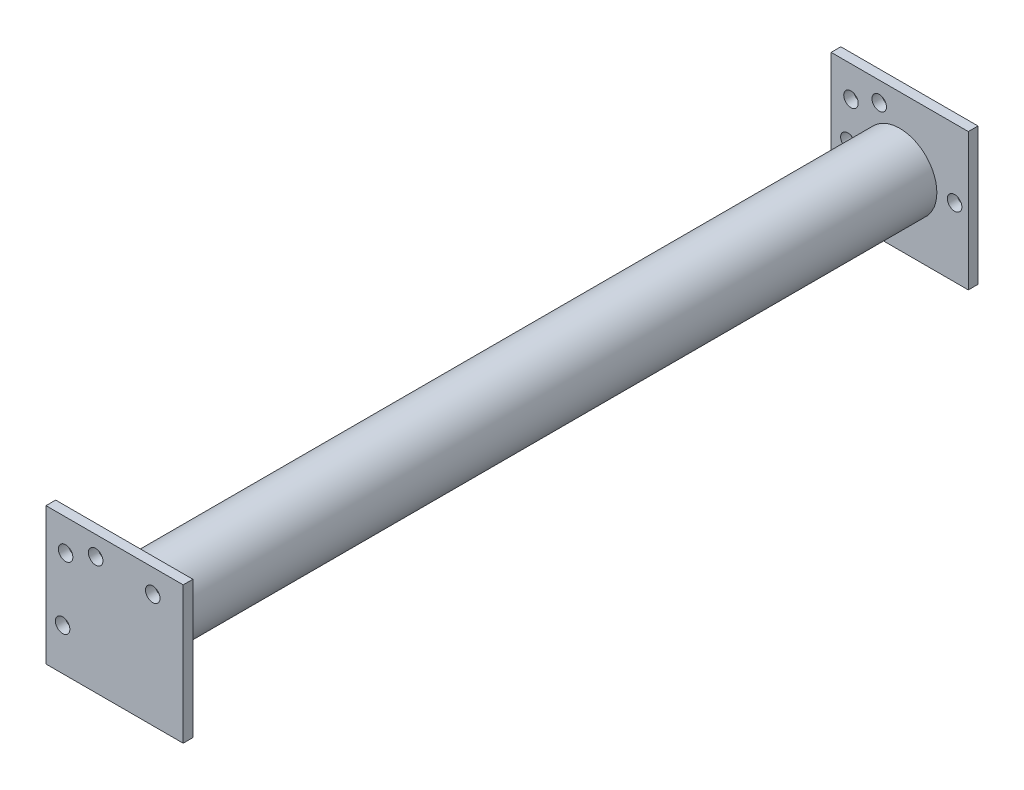
from build123d import *

# Parameters (mm, degrees)
SKETCH1_R           = 46
SKETCH1_R_2         = 40
BOSS_EXTRUDE1_DEPTH = 961
SKETCH2_W           = 170
SKETCH2_H           = 170
SKETCH2_R           = 9
BOSS_EXTRUDE2_DEPTH = 12
SKETCH3_W           = 170
SKETCH3_H           = 170
SKETCH3_R           = 9
BOSS_EXTRUDE3_DEPTH = 12


with BuildPart() as part:
    # Sketch1 → Boss-Extrude1 (new body)
    with BuildSketch(Plane.XY):
        Circle(SKETCH1_R)
        Circle(SKETCH1_R_2, mode=Mode.SUBTRACT)
    extrude(amount=BOSS_EXTRUDE1_DEPTH)

    # Sketch2 → Boss-Extrude2 (add)
    with BuildSketch(Plane(origin=(0, 0, 0), x_dir=(-1, 0, 0), z_dir=(0, 0, -1))):
        Rectangle(SKETCH2_W, SKETCH2_H)
        with Locations((64.227589169, 0)):
            Circle(SKETCH2_R, mode=Mode.SUBTRACT)
        with Locations((-68.030538528, 0)):
            Circle(SKETCH2_R, mode=Mode.SUBTRACT)
        with Locations((60.407969797, 46.896616819)):
            Circle(SKETCH2_R, mode=Mode.SUBTRACT)
        with Locations((25.416815813, 60.663628222)):
            Circle(SKETCH2_R, mode=Mode.SUBTRACT)
    extrude(amount=BOSS_EXTRUDE2_DEPTH)

    # Sketch3 → Boss-Extrude3 (add)
    with BuildSketch(Plane.XY.offset(961)):
        Rectangle(SKETCH3_W, SKETCH3_H)
        with Locations((47.306709653, 56.060313407)):
            Circle(SKETCH3_R, mode=Mode.SUBTRACT)
        with Locations((-23.467107938, 60.902732505)):
            Circle(SKETCH3_R, mode=Mode.SUBTRACT)
        with Locations((-60.716485617, 46.226195512)):
            Circle(SKETCH3_R, mode=Mode.SUBTRACT)
        with Locations((-64.441423385, -32.965699246)):
            Circle(SKETCH3_R, mode=Mode.SUBTRACT)
    extrude(amount=BOSS_EXTRUDE3_DEPTH)


solid = part.part
